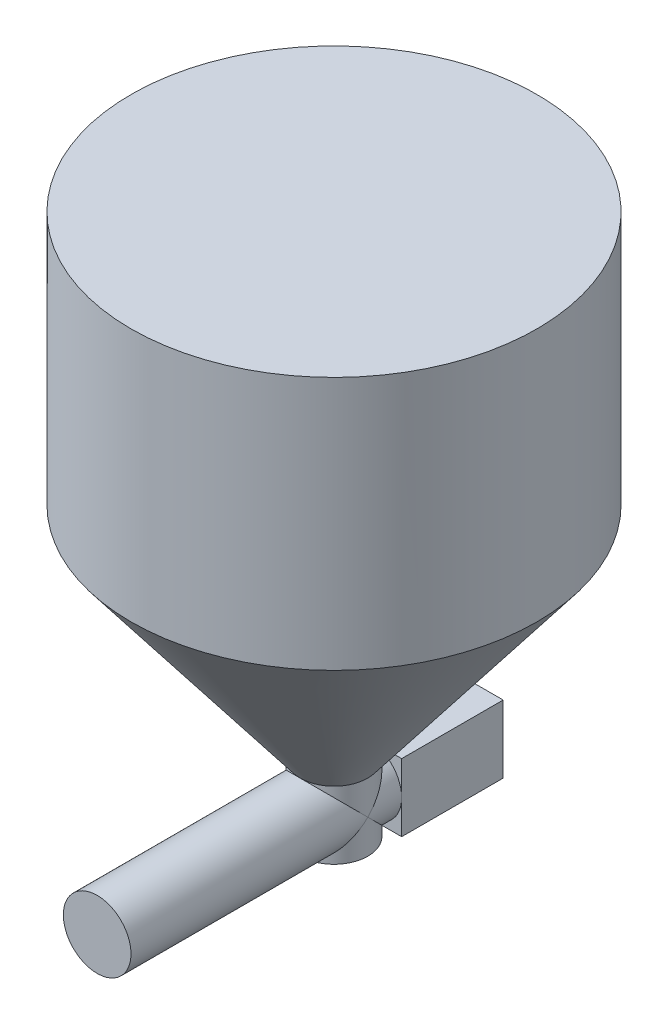
from build123d import *

# Parameters (mm, degrees)
CROQUIS1_R              = 300
SALIENTE_EXTRUIR1_DEPTH = 375
CROQUIS3_R              = 50
CROQUIS2_R              = 300
CROQUIS4_R              = 50
SALIENTE_EXTRUIR2_DEPTH = 100
CROQUIS5_R              = 50
SALIENTE_EXTRUIR3_DEPTH = 400
CROQUIS6_W              = 100
CROQUIS6_H              = 100
SALIENTE_EXTRUIR4_DEPTH = 150


with BuildPart() as part:
    # Croquis1 → Saliente-Extruir1 (new body)
    with BuildSketch(Plane(origin=(0, 0, 0), x_dir=(1, 0, 0), z_dir=(0, 1, 0))):
        with Locations(Location((0, 0, 0), (0, 0, 270))):
            Circle(CROQUIS1_R)
    extrude(amount=-SALIENTE_EXTRUIR1_DEPTH)

    # Croquis3 → Recubrir1 section 0
    with BuildSketch(Plane(origin=(0, -700, 0), x_dir=(1, 0, 0), z_dir=(0, 1, 0))):
        Circle(CROQUIS3_R)
    # Croquis2 → Recubrir1 section 1
    with BuildSketch(Plane.XZ.offset(375)):
        Circle(CROQUIS2_R)
    loft()

    # Croquis4 → Saliente-Extruir2 (add)
    with BuildSketch(Plane.XZ.offset(700)):
        with Locations(Location((0, 0, 0), (0, 0, 270))):
            Circle(CROQUIS4_R)
    extrude(amount=SALIENTE_EXTRUIR2_DEPTH)

    # Croquis5 → Saliente-Extruir3 (add)
    with BuildSketch(Plane(origin=(0, 0, -50), x_dir=(-1, 0, 0), z_dir=(0, 0, -1))):
        with Locations((0, -750)):
            Circle(CROQUIS5_R)
    extrude(amount=-SALIENTE_EXTRUIR3_DEPTH)

    # Croquis6 → Saliente-Extruir4 (add)
    with BuildSketch(Plane(origin=(0, 0, -50), x_dir=(-1, 0, 0), z_dir=(0, 0, -1))):
        with Locations((0, -750)):
            Rectangle(CROQUIS6_W, CROQUIS6_H)
    extrude(amount=SALIENTE_EXTRUIR4_DEPTH)


solid = part.part
